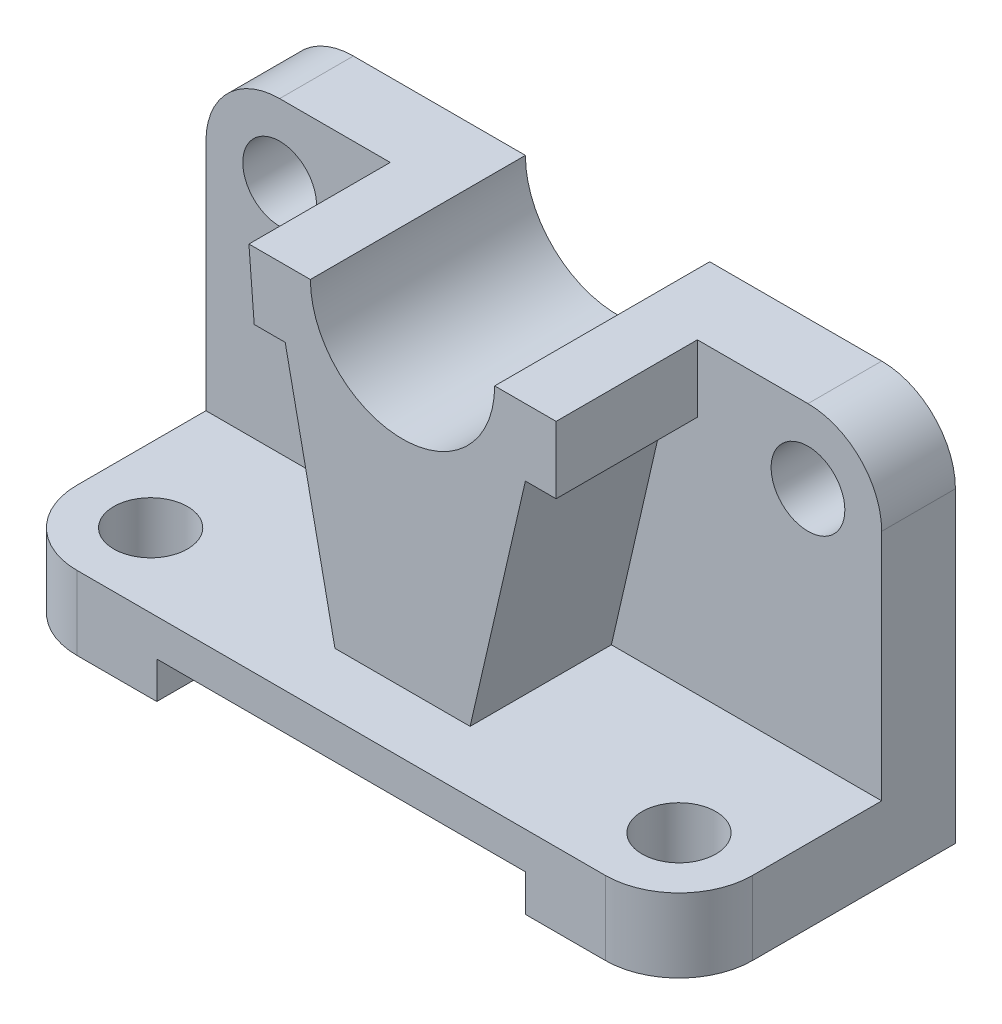
from build123d import *

# Parameters (mm, degrees)
BOSS_EXTRUDE1_DEPTH = 110
BOSS_EXTRUDE2_DEPTH = 23
CUT_EXTRUDE1_START  = -23
CUT_EXTRUDE1_DEPTH  = 23
SKETCH6_W           = 60
SKETCH6_H           = 6
CUT_EXTRUDE2_DEPTH  = 153
FILLET1_R           = 12
SKETCH9_R           = 6
CUT_EXTRUDE3_DEPTH  = 153
FILLET3_R           = 12
SKETCH10_R          = 6
CUT_EXTRUDE4_DEPTH  = 153
SKETCH11_R          = 6
CUT_EXTRUDE5_DEPTH  = 153


with BuildPart() as part:
    # Sketch1 → Boss-Extrude1 (new body)
    with BuildSketch(Plane(origin=(0, 0, 0), x_dir=(0, 0, -1), z_dir=(1, 0, 0))):
        Polygon((0, 0), (0, -62), (-45, -62), (-45, -50), (-12, -50), (-12, 0), align=None)
    extrude(amount=BOSS_EXTRUDE1_DEPTH)

    # Sketch4 → Boss-Extrude2 (add)
    with BuildSketch(Plane.XY.offset(12)):
        with BuildLine():
            Line((30, 0), (40, 0))
            ThreePointArc((40, 0), (55, -15), (70, 0))
            Line((70, 0), (80, 0))
            Line((80, 0), (80, -10.913379379))
            Line((80, -10.913379379), (75, -10.913379379))
            Line((75, -10.913379379), (66, -50))
            Line((66, -50), (44, -50))
            Line((44, -50), (35.902837649, -10.913379379))
            Line((35.902837649, -10.913379379), (30.855515073, -10.913379379))
            Line((30.855515073, -10.913379379), (30, 0))
        make_face()
    extrude(amount=BOSS_EXTRUDE2_DEPTH)

    # Sketch5 → Cut-Extrude1 (cut)
    with BuildSketch(Plane.XY.offset(12).offset(CUT_EXTRUDE1_START)):
        with BuildLine():
            Line((70, 0), (40, 0))
            ThreePointArc((40, 0), (55, -15), (70, 0))
        make_face()
    extrude(amount=CUT_EXTRUDE1_DEPTH, mode=Mode.SUBTRACT)

    # Sketch6 → Cut-Extrude2 (cut)
    with BuildSketch(Plane.XY.offset(45)):
        with Locations((55, -59)):
            Rectangle(SKETCH6_W, SKETCH6_H)
    extrude(amount=-CUT_EXTRUDE2_DEPTH, mode=Mode.SUBTRACT)

    # Fillet1
    fillet1_edges = [part.edges().sort_by_distance(p)[0] for p in [
        (110, -56, 45),
        (0, -56, 45),
    ]]
    fillet(fillet1_edges, radius=FILLET1_R)

    # Sketch9 → Cut-Extrude3 (cut)
    with BuildSketch(Plane(origin=(0, -50, 0), x_dir=(1, 0, 0), z_dir=(0, 1, 0))):
        with Locations(Location((12, -33, 0), (0, 0, 270))):
            Circle(SKETCH9_R)
    cut_extrude3 = extrude(amount=-CUT_EXTRUDE3_DEPTH, mode=Mode.SUBTRACT)

    # Mirror1: Cut-Extrude3 across plane
    add(cut_extrude3.mirror(Plane.ZY.offset(-55)), mode=Mode.SUBTRACT)

    # Fillet3
    fillet3_edges = [part.edges().sort_by_distance(p)[0] for p in [
        (110, 0, 6),
        (0, 0, 6),
    ]]
    fillet(fillet3_edges, radius=FILLET3_R)

    # Sketch10 → Cut-Extrude4 (cut)
    with BuildSketch(Plane(origin=(0, 0, 0), x_dir=(-1, 0, 0), z_dir=(0, 0, -1))):
        with Locations((-12, -12)):
            Circle(SKETCH10_R)
    extrude(amount=-CUT_EXTRUDE4_DEPTH, mode=Mode.SUBTRACT)

    # Sketch11 → Cut-Extrude5 (cut)
    with BuildSketch(Plane.XY.offset(12)):
        with Locations((98, -12)):
            Circle(SKETCH11_R)
    extrude(amount=-CUT_EXTRUDE5_DEPTH, mode=Mode.SUBTRACT)


solid = part.part
